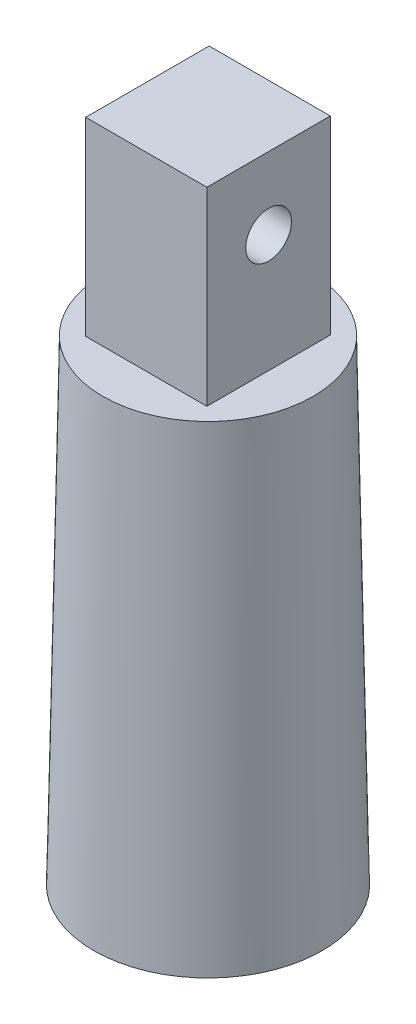
from build123d import *

# Parameters (mm, degrees)
SKETCH1_R           = 5
SKETCH2_R           = 4.6
SKETCH3_W           = 5.3
SKETCH3_H           = 5.4
BOSS_EXTRUDE1_DEPTH = 8.3
SKETCH4_R           = 1
CUT_EXTRUDE1_DEPTH  = 31.501352471


with BuildPart() as part:
    # Sketch1 → Loft1 section 0
    with BuildSketch(Plane(origin=(0, 0, 0), x_dir=(1, 0, 0), z_dir=(0, 1, 0))):
        Circle(SKETCH1_R)
    # Sketch2 → Loft1 section 1
    with BuildSketch(Plane(origin=(0, 20.8, 0), x_dir=(1, 0, 0), z_dir=(0, 1, 0))):
        Circle(SKETCH2_R)
    loft()

    # Sketch3 → Boss-Extrude1 (add)
    with BuildSketch(Plane(origin=(0, 20.8, 0), x_dir=(1, 0, 0), z_dir=(0, 1, 0))):
        Rectangle(SKETCH3_W, SKETCH3_H)
    extrude(amount=BOSS_EXTRUDE1_DEPTH)

    # Sketch4 → Cut-Extrude1 (cut, through all)
    with BuildSketch(Plane.ZY.offset(2.65)):
        with Locations((0, 25.95)):
            Circle(SKETCH4_R)
    extrude(amount=-CUT_EXTRUDE1_DEPTH, mode=Mode.SUBTRACT)


solid = part.part
